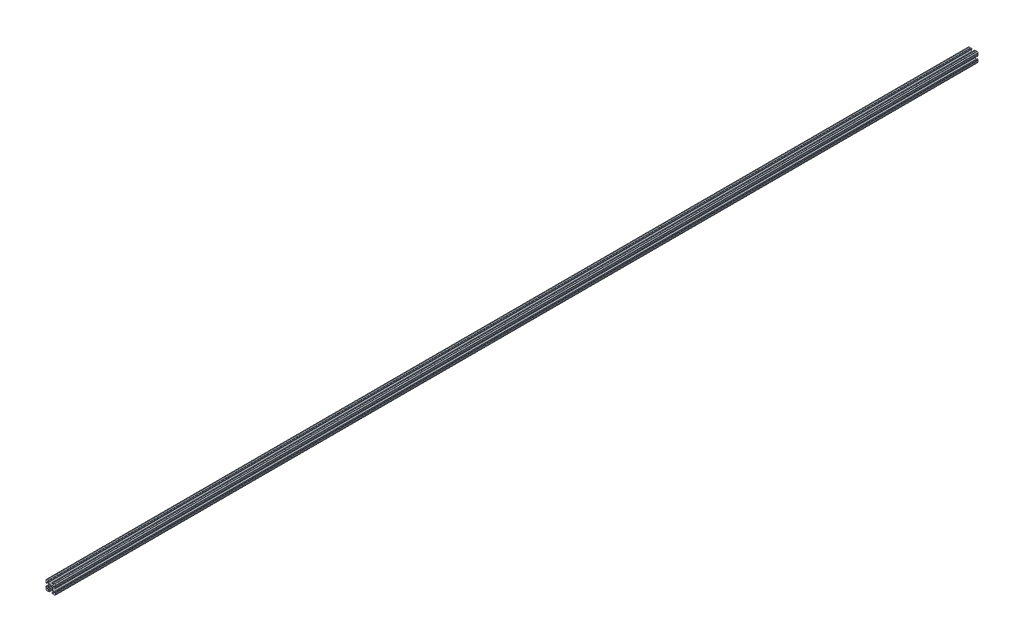
from build123d import *

# Parameters (mm, degrees)
SKETCH1_R           = 2.6035
BOSS_EXTRUDE1_DEPTH = 1219.2


with BuildPart() as part:
    # Sketch1 → Boss-Extrude1 (new, symmetric)
    with BuildSketch(Plane.XY):
        with BuildLine():
            Line((-7.179650497, -8.645192506), (-3.952270251, -5.423690499))
            ThreePointArc((-3.952270251, -5.423690499), (-2.922936451, -4.736929036), (-1.709253557, -4.4958))
            Line((-1.709253557, -4.4958), (1.709253557, -4.4958))
            ThreePointArc((1.709253557, -4.4958), (2.922936451, -4.736929036), (3.952270251, -5.423690499))
            Line((3.952270251, -5.423690499), (7.179650497, -8.645192506))
            ThreePointArc((7.179650497, -8.645192506), (7.41473083, -9.822813117), (6.416408329, -10.4902))
            Line((6.416408329, -10.4902), (4.287512407, -10.4902))
            ThreePointArc((4.287512407, -10.4902), (3.54574862, -10.79744862), (3.2385, -11.539212407))
            Line((3.2385, -11.539212407), (3.2385, -11.650987593))
            ThreePointArc((3.2385, -11.650987593), (3.54574862, -12.39275138), (4.287512407, -12.7))
            Line((4.287512407, -12.7), (5.317126718, -12.7))
            ThreePointArc((5.317126718, -12.7), (5.825126718, -12.192), (6.333126718, -12.7))
            Line((6.333126718, -12.7), (9.550443118, -12.7))
            ThreePointArc((9.550443118, -12.7), (10.058366869, -12.192000006), (10.566443095, -12.699847501))
            ThreePointArc((10.566443095, -12.699847501), (12.082537762, -12.08250727), (12.699846982, -10.566399977))
            ThreePointArc((12.699846982, -10.566399977), (12.192000006, -10.058323491), (12.7, -9.5504))
            Line((12.7, -9.5504), (12.7, -6.3330836))
            ThreePointArc((12.7, -6.3330836), (12.192, -5.8250836), (12.7, -5.3170836))
            Line((12.7, -5.3170836), (12.7, -4.287469289))
            ThreePointArc((12.7, -4.287469289), (12.39275138, -3.545705502), (11.650987593, -3.238456882))
            Line((11.650987593, -3.238456882), (11.539212407, -3.238456882))
            ThreePointArc((11.539212407, -3.238456882), (10.79744862, -3.545705502), (10.4902, -4.287469289))
            Line((10.4902, -4.287469289), (10.4902, -6.402089023))
            ThreePointArc((10.4902, -6.402089023), (9.856505071, -7.351067942), (8.737131347, -7.129408934))
            Line((8.737131347, -7.129408934), (5.441005833, -3.840816462))
            ThreePointArc((5.441005833, -3.840816462), (4.750877967, -2.809883091), (4.5085, -1.593185507))
            Line((4.5085, -1.593185507), (4.5085, 1.593185507))
            ThreePointArc((4.5085, 1.593185507), (4.750877967, 2.809883091), (5.441005833, 3.840816462))
            Line((5.441005833, 3.840816462), (8.737131347, 7.129408934))
            ThreePointArc((8.737131347, 7.129408934), (9.856505071, 7.351067942), (10.4902, 6.402089023))
            Line((10.4902, 6.402089023), (10.4902, 4.287469289))
            ThreePointArc((10.4902, 4.287469289), (10.79744862, 3.545705502), (11.539212407, 3.238456882))
            Line((11.539212407, 3.238456882), (11.650987593, 3.238456882))
            ThreePointArc((11.650987593, 3.238456882), (12.39275138, 3.545705502), (12.7, 4.287469289))
            Line((12.7, 4.287469289), (12.7, 5.3170836))
            ThreePointArc((12.7, 5.3170836), (12.192, 5.8250836), (12.7, 6.3330836))
            Line((12.7, 6.3330836), (12.7, 9.5504))
            ThreePointArc((12.7, 9.5504), (12.192000006, 10.058323491), (12.699846982, 10.566399977))
            ThreePointArc((12.699846982, 10.566399977), (12.082537762, 12.08250727), (10.566443095, 12.699847501))
            ThreePointArc((10.566443095, 12.699847501), (10.058366869, 12.192000006), (9.550443118, 12.7))
            Line((9.550443118, 12.7), (6.333126718, 12.7))
            ThreePointArc((6.333126718, 12.7), (5.825126718, 12.192), (5.317126718, 12.7))
            Line((5.317126718, 12.7), (4.287512407, 12.7))
            ThreePointArc((4.287512407, 12.7), (3.54574862, 12.39275138), (3.2385, 11.650987593))
            Line((3.2385, 11.650987593), (3.2385, 11.539212407))
            ThreePointArc((3.2385, 11.539212407), (3.54574862, 10.79744862), (4.287512407, 10.4902))
            Line((4.287512407, 10.4902), (6.476788598, 10.4902))
            ThreePointArc((6.476788598, 10.4902), (7.432222385, 9.85140422), (7.207036008, 8.724370562))
            Line((7.207036008, 8.724370562), (3.898272566, 5.423169045))
            ThreePointArc((3.898272566, 5.423169045), (2.869120213, 4.736787962), (1.655778399, 4.4958))
            Line((1.655778399, 4.4958), (-1.655778399, 4.4958))
            ThreePointArc((-1.655778399, 4.4958), (-2.869120213, 4.736787962), (-3.898272566, 5.423169045))
            Line((-3.898272566, 5.423169045), (-7.207036008, 8.724370562))
            ThreePointArc((-7.207036008, 8.724370562), (-7.432222385, 9.85140422), (-6.476788598, 10.4902))
            Line((-6.476788598, 10.4902), (-4.287512407, 10.4902))
            ThreePointArc((-4.287512407, 10.4902), (-3.54574862, 10.79744862), (-3.2385, 11.539212407))
            Line((-3.2385, 11.539212407), (-3.2385, 11.650987593))
            ThreePointArc((-3.2385, 11.650987593), (-3.54574862, 12.39275138), (-4.287512407, 12.7))
            Line((-4.287512407, 12.7), (-5.317126718, 12.7))
            ThreePointArc((-5.317126718, 12.7), (-5.825126718, 12.192), (-6.333126718, 12.7))
            Line((-6.333126718, 12.7), (-9.550443118, 12.7))
            ThreePointArc((-9.550443118, 12.7), (-10.058366869, 12.192000006), (-10.566443095, 12.699847501))
            ThreePointArc((-10.566443095, 12.699847501), (-12.082537762, 12.08250727), (-12.699846982, 10.566399977))
            ThreePointArc((-12.699846982, 10.566399977), (-12.192000006, 10.058323491), (-12.7, 9.5504))
            Line((-12.7, 9.5504), (-12.7, 6.3330836))
            ThreePointArc((-12.7, 6.3330836), (-12.192, 5.8250836), (-12.7, 5.3170836))
            Line((-12.7, 5.3170836), (-12.7, 4.287469289))
            ThreePointArc((-12.7, 4.287469289), (-12.39275138, 3.545705502), (-11.650987593, 3.238456882))
            Line((-11.650987593, 3.238456882), (-11.539212407, 3.238456882))
            ThreePointArc((-11.539212407, 3.238456882), (-10.79744862, 3.545705502), (-10.4902, 4.287469289))
            Line((-10.4902, 4.287469289), (-10.4902, 6.402089023))
            ThreePointArc((-10.4902, 6.402089023), (-9.856505071, 7.351067942), (-8.737131347, 7.129408934))
            Line((-8.737131347, 7.129408934), (-5.441005833, 3.840816462))
            ThreePointArc((-5.441005833, 3.840816462), (-4.750877967, 2.809883091), (-4.5085, 1.593185507))
            Line((-4.5085, 1.593185507), (-4.5085, -1.593185507))
            ThreePointArc((-4.5085, -1.593185507), (-4.750877967, -2.809883091), (-5.441005833, -3.840816462))
            Line((-5.441005833, -3.840816462), (-8.737131347, -7.129408934))
            ThreePointArc((-8.737131347, -7.129408934), (-9.856505071, -7.351067942), (-10.4902, -6.402089023))
            Line((-10.4902, -6.402089023), (-10.4902, -4.287469289))
            ThreePointArc((-10.4902, -4.287469289), (-10.79744862, -3.545705502), (-11.539212407, -3.238456882))
            Line((-11.539212407, -3.238456882), (-11.650987593, -3.238456882))
            ThreePointArc((-11.650987593, -3.238456882), (-12.39275138, -3.545705502), (-12.7, -4.287469289))
            Line((-12.7, -4.287469289), (-12.7, -5.3170836))
            ThreePointArc((-12.7, -5.3170836), (-12.192, -5.8250836), (-12.7, -6.3330836))
            Line((-12.7, -6.3330836), (-12.7, -9.5504))
            ThreePointArc((-12.7, -9.5504), (-12.192000006, -10.058323491), (-12.699846982, -10.566399977))
            ThreePointArc((-12.699846982, -10.566399977), (-12.082537762, -12.08250727), (-10.566443095, -12.699847501))
            ThreePointArc((-10.566443095, -12.699847501), (-10.058366869, -12.192000006), (-9.550443118, -12.7))
            Line((-9.550443118, -12.7), (-6.333126718, -12.7))
            ThreePointArc((-6.333126718, -12.7), (-5.825126718, -12.192), (-5.317126718, -12.7))
            Line((-5.317126718, -12.7), (-4.287512407, -12.7))
            ThreePointArc((-4.287512407, -12.7), (-3.54574862, -12.39275138), (-3.2385, -11.650987593))
            Line((-3.2385, -11.650987593), (-3.2385, -11.539212407))
            ThreePointArc((-3.2385, -11.539212407), (-3.54574862, -10.79744862), (-4.287512407, -10.4902))
            Line((-4.287512407, -10.4902), (-6.416408329, -10.4902))
            ThreePointArc((-6.416408329, -10.4902), (-7.41473083, -9.822813117), (-7.179650497, -8.645192506))
        make_face()
        with Locations(Location((0, 0, 0), (0, 0, 180))):
            Circle(SKETCH1_R, mode=Mode.SUBTRACT)
    extrude(amount=BOSS_EXTRUDE1_DEPTH, both=True)


solid = part.part
